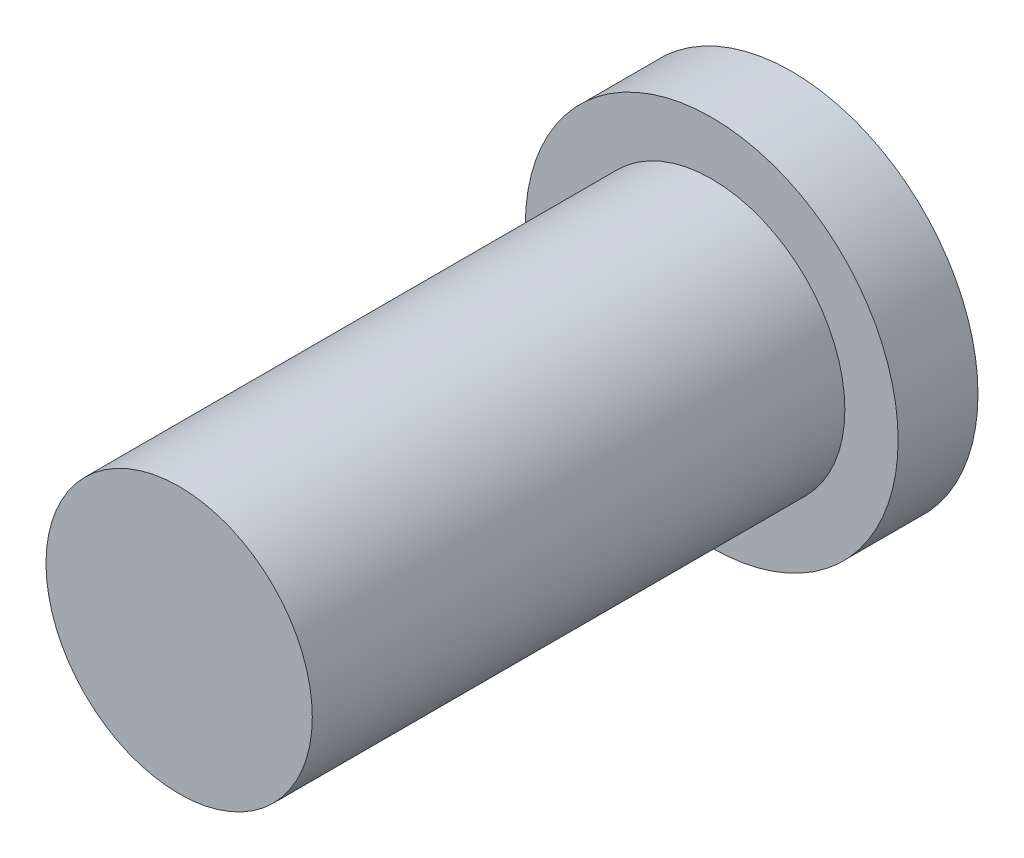
from build123d import *

# Parameters (mm, degrees)
SKETCH2_R           = 2.5
BOSS_EXTRUDE1_DEPTH = 10
SKETCH3_R           = 3.5
BOSS_EXTRUDE2_DEPTH = 1.5


with BuildPart() as part:
    # Sketch2 → Boss-Extrude1 (new body)
    with BuildSketch(Plane.XY):
        Circle(SKETCH2_R)
    extrude(amount=BOSS_EXTRUDE1_DEPTH)

    # Sketch3 → Boss-Extrude2 (add)
    with BuildSketch(Plane(origin=(0, 0, 0), x_dir=(-1, 0, 0), z_dir=(0, 0, -1))):
        Circle(SKETCH3_R)
    extrude(amount=BOSS_EXTRUDE2_DEPTH)


solid = part.part
